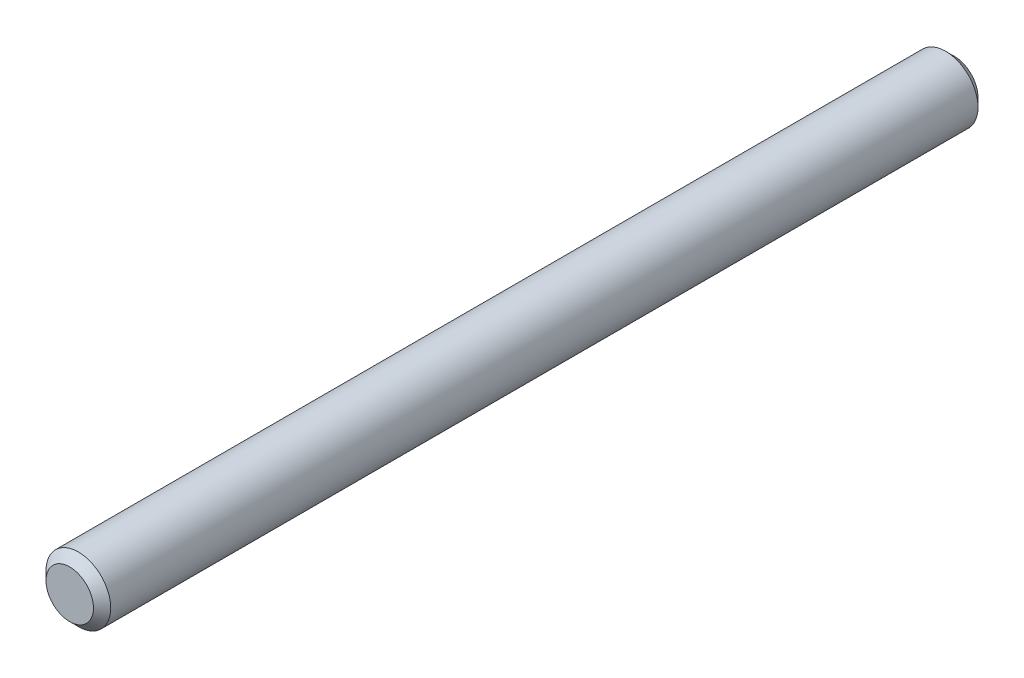
from build123d import *

# Parameters (mm, degrees)
SKETCH1_R           = 4.7625
BOSS_EXTRUDE1_DEPTH = 130.175
CHAMFER1_SIZE       = 1.27


with BuildPart() as part:
    # Sketch1 → Boss-Extrude1 (new body)
    with BuildSketch(Plane.XY):
        Circle(SKETCH1_R)
    extrude(amount=-BOSS_EXTRUDE1_DEPTH)

    # Chamfer1
    chamfer1_edges = [part.edges().sort_by_distance(p)[0] for p in [
        (-4.7625, 0, 0),
        (-4.7625, 0, -130.175),
    ]]
    chamfer(chamfer1_edges, length=CHAMFER1_SIZE)


solid = part.part
